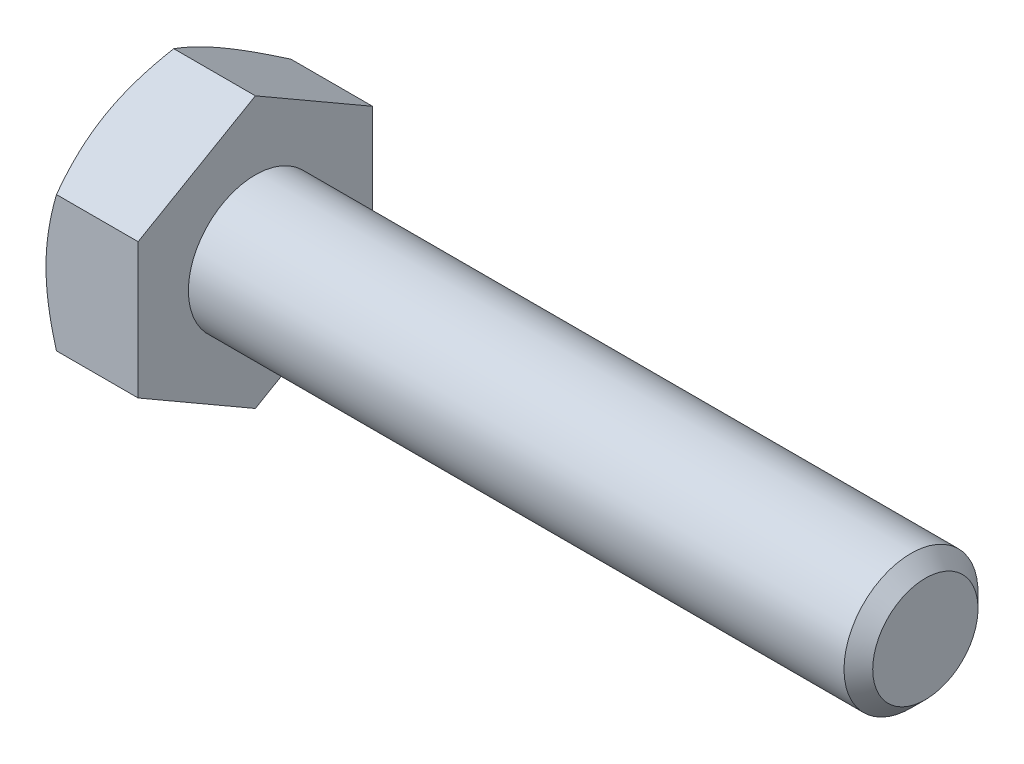
from build123d import *

# Parameters (mm, degrees)
SKETCH5_R           = 3.175
BOSS_EXTRUDE3_DEPTH = 31.75
CHAMFER1_SIZE       = 0.680357143
BOSS_EXTRUDE4_DEPTH = 4.365625
SKETCH8_OUTSIDE_W   = 153.074
SKETCH8_OUTSIDE_H   = 154.794
SKETCH8_OUTSIDE_R   = 5.55625
CUT_EXTRUDE3_DEPTH  = 38.099499124
CUT_EXTRUDE3_DRAFT  = -60


with BuildPart() as part:
    # Sketch5 → Boss-Extrude3 (new body)
    with BuildSketch(Plane(origin=(18.0578125, 0, 0), x_dir=(0, 0, -1), z_dir=(1, 0, 0))):
        Circle(SKETCH5_R)
    extrude(amount=-BOSS_EXTRUDE3_DEPTH)

    # Chamfer1
    chamfer1_edges = [part.edges().sort_by_distance(p)[0] for p in [
        (18.0578125, 0, 3.175),
    ]]
    chamfer(chamfer1_edges, length=CHAMFER1_SIZE)

    # Sketch6 → Boss-Extrude4 (add)
    with BuildSketch(Plane.ZY.offset(13.6921875)):
        Polygon((5.55625, 3.207902433), (0, 6.415804866), (-5.55625, 3.207902433), (-5.55625, -3.207902433), (0, -6.415804866), (5.55625, -3.207902433), align=None)
    extrude(amount=BOSS_EXTRUDE4_DEPTH)


with BuildPart() as cut_extrude3_tool:
    # Sketch8 outside → Cut-Extrude3 (with draft: the straight prism first)
    with BuildSketch(Plane.ZY.offset(18.0578125)):
        Rectangle(SKETCH8_OUTSIDE_W, SKETCH8_OUTSIDE_H)
        Circle(SKETCH8_OUTSIDE_R, mode=Mode.SUBTRACT)
    extrude(amount=-CUT_EXTRUDE3_DEPTH)
    # Cut-Extrude3: the draft: its side faces are tilted about the plane it starts from
    cut_extrude3_sides = [cut_extrude3_tool.faces().sort_by_distance(p)[0] for p in [
        (0.991937062, -77.397, 0),
        (0.991937062, 0, 76.537),
        (0.991937062, 77.397, 0),
        (0.991937062, 0, -76.537),
        (0.991937062, 0, -5.55625),
    ]]
    draft(cut_extrude3_sides, Plane.ZY.offset(18.0578125), CUT_EXTRUDE3_DRAFT)


with BuildPart() as part_1:
    add(part.part)

    # Cut-Extrude3: cut by cut_extrude3_tool
    add(cut_extrude3_tool.part, mode=Mode.SUBTRACT)


solid = part_1.part
